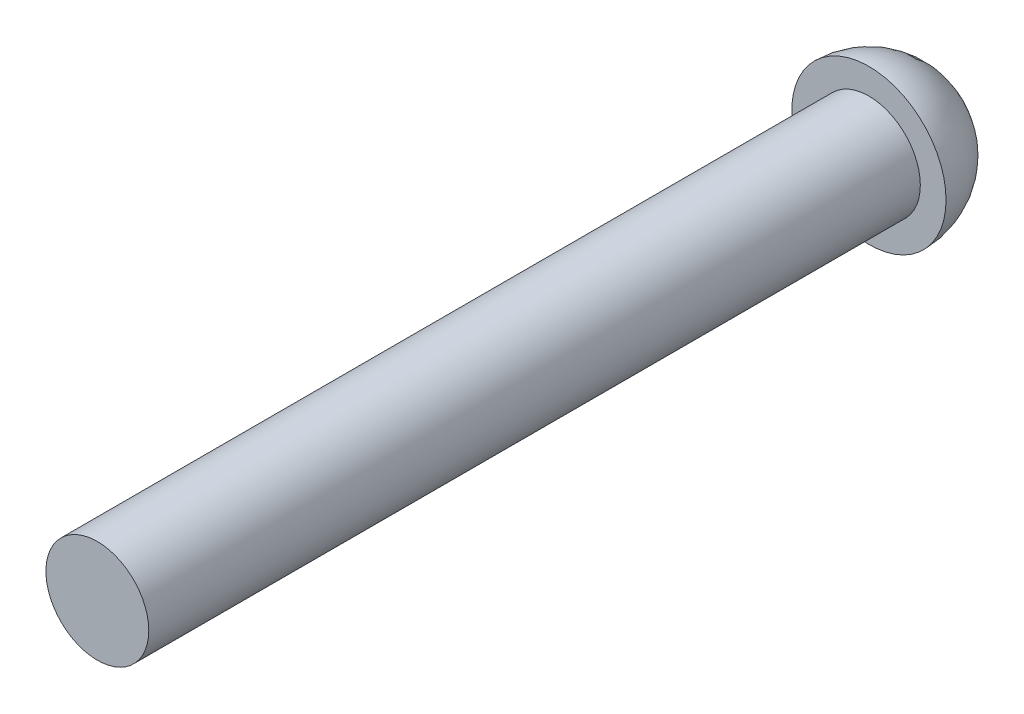
from build123d import *

# Parameters (mm, degrees)
ESQUISSE1_R                  = 1
BOSS_EXTRU_1_DEPTH           = 15
ENL_V_MAT_EXTRU_1_DEPTH      = 10
ENL_V_MAT_EXTRU_1_DEPTH_BACK = 10
ESQUISSE4_W                  = 0.167865562
ESQUISSE4_H                  = 1.310923544


with BuildPart() as part:
    # Esquisse1 → Boss.-Extru.1 (new body)
    with BuildSketch(Plane.XY):
        Circle(ESQUISSE1_R)
    extrude(amount=BOSS_EXTRU_1_DEPTH)

    # Esquisse2 → Révolution1 (revolve)
    with BuildSketch(Plane(origin=(0, 0, 0), x_dir=(1, 0, 0), z_dir=(0, 1, 0))):
        with BuildLine():
            Line((0, 0), (0, 1.5))
            ThreePointArc((0, 1.5), (1.060660172, 1.060660172), (1.5, 0))
            Line((1.5, 0), (0, 0))
        make_face()
    revolve(axis=Axis((0, 0, 0), (0, 0, -1)))

    # Esquisse4 → Enlèv. mat.-Extru.1 (cut, two sides: drawn at the far end of the back side and taken through both)
    with BuildSketch(Plane(origin=(0, 0, 0), x_dir=(1, 0, 0), z_dir=(0, 1, 0)).offset(-ENL_V_MAT_EXTRU_1_DEPTH_BACK)):
        with Locations((0, 1.5)):
            Rectangle(ESQUISSE4_W, ESQUISSE4_H)
    extrude(amount=ENL_V_MAT_EXTRU_1_DEPTH + ENL_V_MAT_EXTRU_1_DEPTH_BACK, mode=Mode.SUBTRACT)


solid = part.part
